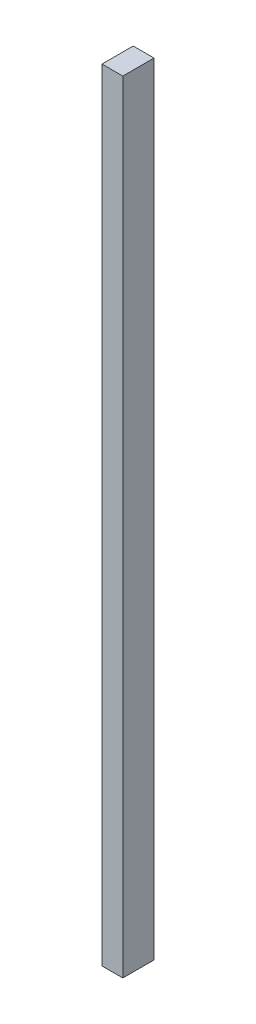
from build123d import *

# Parameters (mm, degrees)
SKETCH1_W           = 8
SKETCH1_H           = 12
BOSS_EXTRUDE1_DEPTH = 300


with BuildPart() as part:
    # Sketch1 → Boss-Extrude1 (new body)
    with BuildSketch(Plane(origin=(0, 0, 0), x_dir=(1, 0, 0), z_dir=(0, 1, 0))):
        Rectangle(SKETCH1_W, SKETCH1_H)
    extrude(amount=BOSS_EXTRUDE1_DEPTH)


solid = part.part
